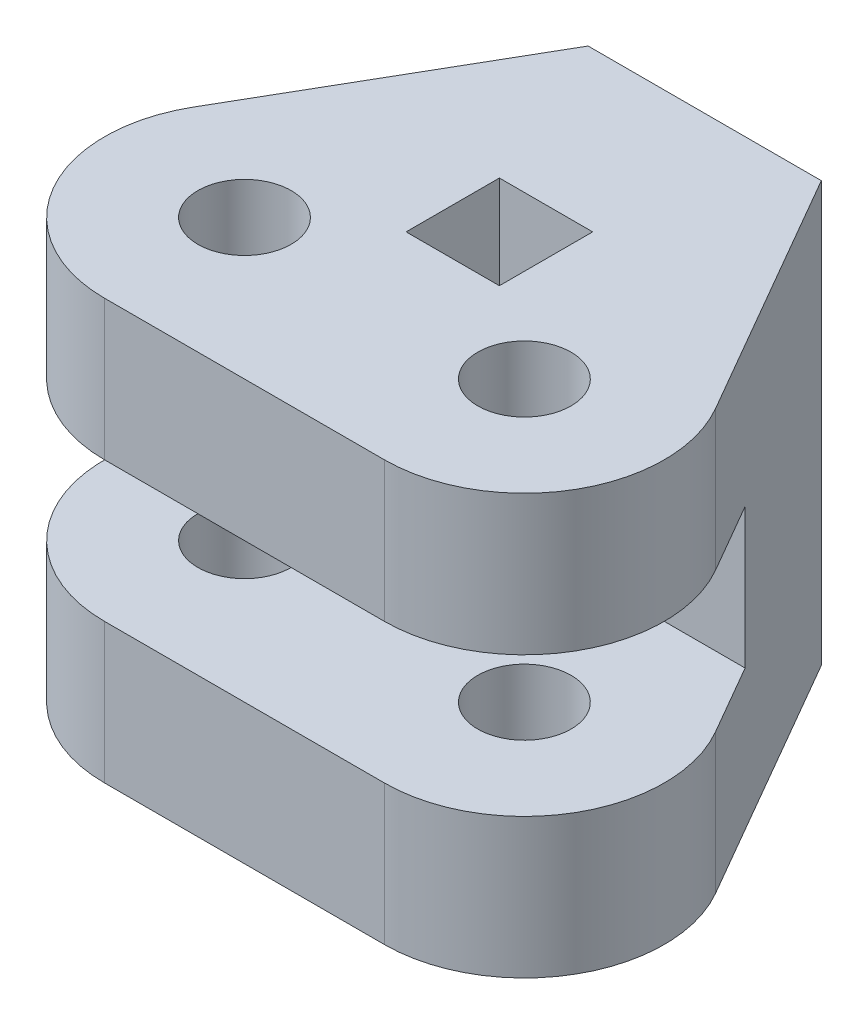
from build123d import *

# Parameters (mm, degrees)
CROQUIS1_R              = 1
CROQUIS1_W              = 2
CROQUIS1_H              = 2
SALIENTE_EXTRUIR1_DEPTH = 9
CROQUIS2_W              = 12
CROQUIS2_H              = 3
CORTAR_EXTRUIR1_DEPTH   = 6
CORTAR_EXTRUIR2_REACH   = 16.64
CROQUIS3_R              = 0.5


with BuildPart() as part:
    # Croquis1 → Saliente-Extruir1 (new body)
    with BuildSketch(Plane(origin=(0, 0, 0), x_dir=(1, 0, 0), z_dir=(0, 1, 0))):
        with BuildLine():
            Line((5.598076211, -3.696152423), (2.5, 1.669872981))
            Line((2.5, 1.669872981), (-2.5, 1.669872981))
            Line((-2.5, 1.669872981), (-5.598076211, -3.696152423))
            ThreePointArc((-5.598076211, -3.696152423), (-5.598076211, -6.696152423), (-3, -8.196152423))
            Line((-3, -8.196152423), (3, -8.196152423))
            ThreePointArc((3, -8.196152423), (5.598076211, -6.696152423), (5.598076211, -3.696152423))
        make_face()
        with Locations(Location((-3, -5.196152423, 0), (0, 0, 270))):
            Circle(CROQUIS1_R, mode=Mode.SUBTRACT)
        with Locations(Location((3, -5.196152423, 0), (0, 0, 270))):
            Circle(CROQUIS1_R, mode=Mode.SUBTRACT)
        with Locations((0, -2.732050808)):
            Rectangle(CROQUIS1_W, CROQUIS1_H, mode=Mode.SUBTRACT)
    extrude(amount=SALIENTE_EXTRUIR1_DEPTH)

    # Croquis2 → Cortar-Extruir1 (cut)
    with BuildSketch(Plane.XY.offset(8.196152423)):
        with Locations((0, 4.5)):
            Rectangle(CROQUIS2_W, CROQUIS2_H)
    extrude(amount=-CORTAR_EXTRUIR1_DEPTH, mode=Mode.SUBTRACT)

    # Croquis3 → Cortar-Extruir2 (cut, up to next)
    with BuildSketch(Plane(origin=(0, 0, -1.669872981), x_dir=(-1, 0, 0), z_dir=(0, 0, -1)), mode=Mode.PRIVATE) as cortar_extruir2_sk1:
        with Locations((0, 4.5)):
            Circle(CROQUIS3_R)
    cortar_extruir2_tool1 = extrude(cortar_extruir2_sk1.sketch, amount=-CORTAR_EXTRUIR2_REACH, mode=Mode.PRIVATE) & part.part
    add(cortar_extruir2_tool1.solids().sort_by_distance((0, 4.5, -1.669873))[0], mode=Mode.SUBTRACT)


solid = part.part
